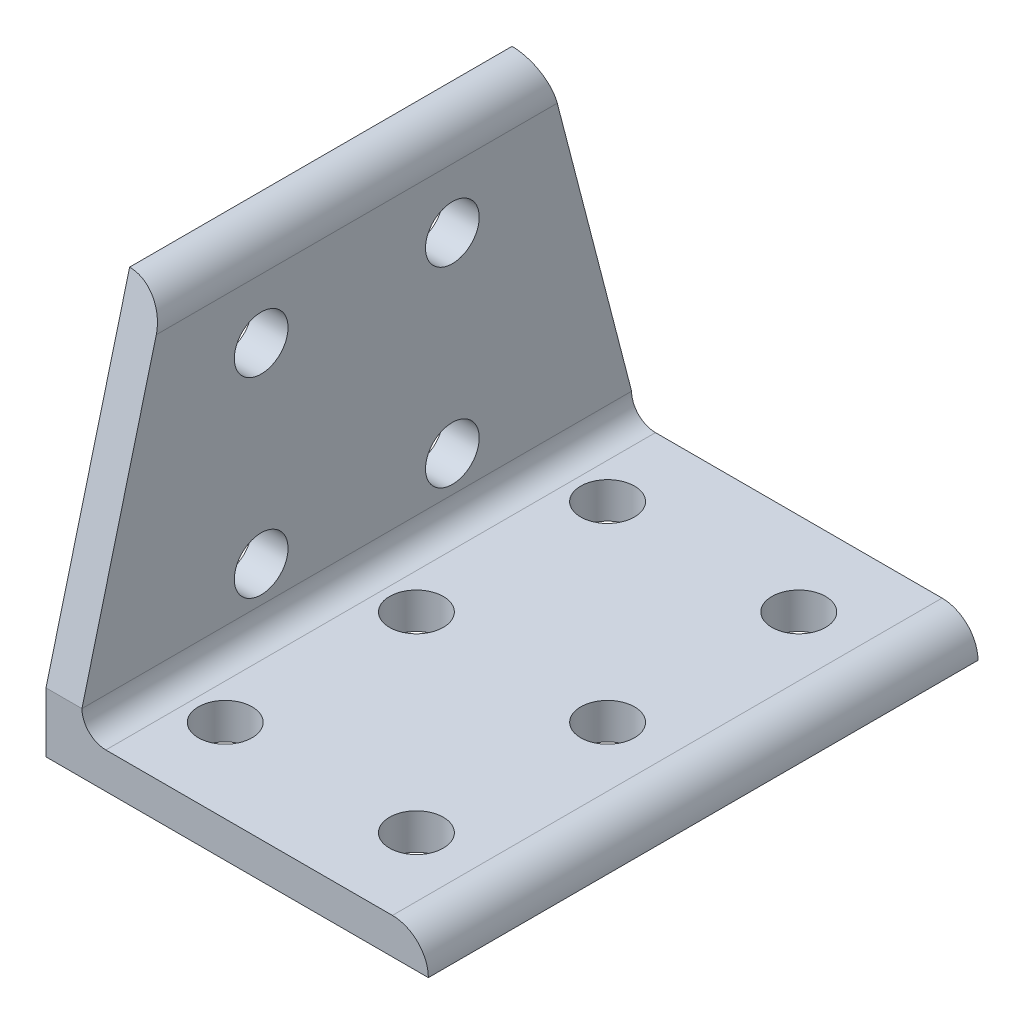
from build123d import *

# Parameters (mm, degrees)
BOSS_EXTRUDE1_DEPTH      = 36.5125
BOSS_EXTRUDE1_DEPTH_BACK = 36.5125
CUT_EXTRUDE1_DEPTH       = 65.004725383
CUT_EXTRUDE1_DEPTH_BACK  = 65.004725383
CUT_EXTRUDE2_DEPTH       = 65.004725383
CUT_EXTRUDE2_DEPTH_BACK  = 65.004725383
SKETCH6_R                = 3.5687
SKETCH7_R                = 3.5687
CUT_EXTRUDE3_DEPTH       = 65.004725383


with BuildPart() as part:
    # Sketch4 → Boss-Extrude1 (new, two sides: drawn at the far end of the back side and taken through both)
    with BuildSketch(Plane.XY.offset(-BOSS_EXTRUDE1_DEPTH_BACK)):
        with BuildLine():
            Line((-25.4, 25.4), (-25.4, -25.4))
            Line((-25.4, -25.4), (25.4, -25.4))
            ThreePointArc((25.4, -25.4), (24.001376302, -22.023423698), (20.6248, -20.6248))
            Line((20.6248, -20.6248), (-17.4498, -20.6248))
            ThreePointArc((-17.4498, -20.6248), (-19.69486403, -19.69486403), (-20.6248, -17.4498))
            Line((-20.6248, -17.4498), (-20.6248, 20.6248))
            ThreePointArc((-20.6248, 20.6248), (-22.023423698, 24.001376302), (-25.4, 25.4))
        make_face()
    extrude(amount=BOSS_EXTRUDE1_DEPTH + BOSS_EXTRUDE1_DEPTH_BACK)

    # Sketch5 → Cut-Extrude1 (cut, two sides: drawn at the far end of the back side and taken through both)
    with BuildSketch(Plane(origin=(-20.6248, 0, 0), x_dir=(0, 0, -1), z_dir=(1, 0, 0)).offset(-CUT_EXTRUDE1_DEPTH_BACK)):
        Polygon((-36.5125, -17.4498), (-25.4, 25.4), (-36.5125, 25.4), align=None)
        Polygon((36.5125, 25.4), (25.4, 25.4), (36.5125, -17.4498), align=None)
    extrude(amount=CUT_EXTRUDE1_DEPTH + CUT_EXTRUDE1_DEPTH_BACK, mode=Mode.SUBTRACT)

    # Sketch6 → Cut-Extrude2 (cut, two sides: drawn at the far end of the back side and taken through both)
    with BuildSketch(Plane(origin=(-20.6248, 0, 0), x_dir=(0, 0, -1), z_dir=(1, 0, 0)).offset(-CUT_EXTRUDE2_DEPTH_BACK)):
        with Locations(Location((-12.7, 12.7, 0), (0, 0, 90))):
            Circle(SKETCH6_R)
        with Locations(Location((-12.7, -12.7, 0), (0, 0, 90))):
            Circle(SKETCH6_R)
        with Locations(Location((12.7, -12.7, 0), (0, 0, 90))):
            Circle(SKETCH6_R)
        with Locations(Location((12.7, 12.7, 0), (0, 0, 90))):
            Circle(SKETCH6_R)
    extrude(amount=CUT_EXTRUDE2_DEPTH + CUT_EXTRUDE2_DEPTH_BACK, mode=Mode.SUBTRACT)

    # Sketch7 → Cut-Extrude3 (cut, through all)
    with BuildSketch(Plane(origin=(0, -20.6248, 0), x_dir=(1, 0, 0), z_dir=(0, 1, 0))):
        with Locations(Location((-12.7, 0, 0), (0, 0, 180))):
            Circle(SKETCH7_R)
        with Locations(Location((-12.7, 25.4, 0), (0, 0, 180))):
            Circle(SKETCH7_R)
        with Locations(Location((-12.7, -25.4, 0), (0, 0, 180))):
            Circle(SKETCH7_R)
        with Locations((12.7, -25.4)):
            Circle(SKETCH7_R)
        with Locations((12.7, 25.4)):
            Circle(SKETCH7_R)
        with Locations((12.7, 0)):
            Circle(SKETCH7_R)
    extrude(amount=-CUT_EXTRUDE3_DEPTH, mode=Mode.SUBTRACT)


solid = part.part
